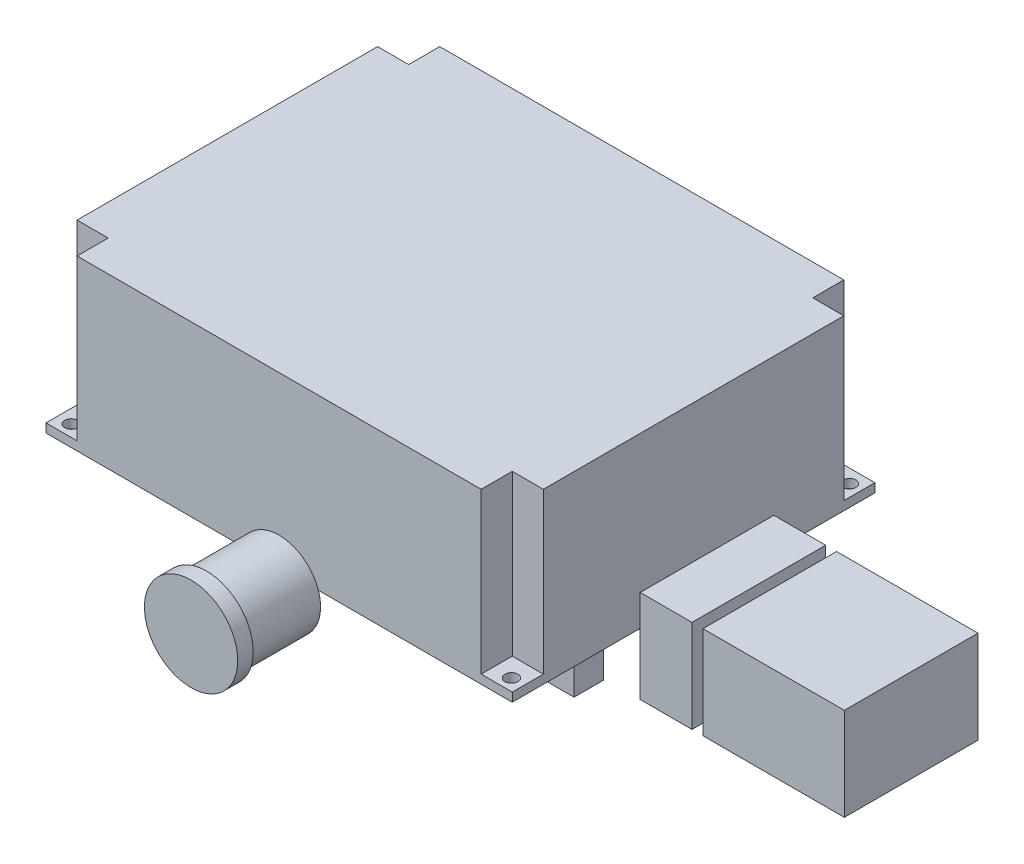
from build123d import *

# Parameters (mm, degrees)
SKETCH2_W               = 90
SKETCH2_H               = 70
BOSS_EXTRUDE1_DEPTH     = 32.6
SKETCH4_R               = 8
BOSS_EXTRUDE2_DEPTH     = 14
SKETCH6_W               = 6.6
SKETCH6_H               = 5.7
BOSS_EXTRUDE3_DEPTH     = 10
SKETCH10_W              = 6.6
SKETCH10_H              = 5.7
BOSS_EXTRUDE4_DEPTH     = 10
SKETCH7_W               = 6.6
SKETCH7_H               = 5.7
BOSS_EXTRUDE5_DEPTH     = 10
CUT_EXTRUDE1_DEPTH      = 122.916565322
CUT_EXTRUDE1_DEPTH_BACK = 122.916565322
SKETCH11_R              = 1.25
CUT_EXTRUDE2_DEPTH      = 122.916565322
CUT_EXTRUDE2_DEPTH_BACK = 122.916565322
SKETCH15_R              = 1.25
CUT_EXTRUDE3_DEPTH      = 122.916565322
CUT_EXTRUDE3_DEPTH_BACK = 122.916565322
SKETCH14_R              = 1.25
CUT_EXTRUDE4_DEPTH      = 122.916565322
CUT_EXTRUDE4_DEPTH_BACK = 122.916565322
SKETCH12_R              = 1.25
SKETCH16_W              = 6
SKETCH16_H              = 6
CUT_EXTRUDE5_DEPTH      = 30.9
SKETCH19_W              = 6
SKETCH19_H              = 6
CUT_EXTRUDE6_DEPTH      = 30.9
SKETCH18_W              = 6
SKETCH18_H              = 6
CUT_EXTRUDE7_DEPTH      = 30.9
SKETCH17_W              = 6
SKETCH17_H              = 6
CUT_EXTRUDE8_DEPTH      = 30.9
SKETCH20_W              = 25.8
SKETCH20_H              = 17.9
BOSS_EXTRUDE6_DEPTH     = 39.4
SKETCH22_W              = 2.1
SKETCH22_H              = 17.9
CUT_EXTRUDE9_DEPTH      = 2.75
SKETCH24_W              = 2.1
SKETCH24_H              = 25.8
CUT_EXTRUDE10_DEPTH     = 2.75
SKETCH25_W              = 2.1
SKETCH25_H              = 17.9
CUT_EXTRUDE11_DEPTH     = 2.75
SKETCH26_W              = 2.1
SKETCH26_H              = 25.8
CUT_EXTRUDE12_DEPTH     = 2.75
SKETCH27_R              = 9
BOSS_EXTRUDE7_DEPTH     = 3


with BuildPart() as part:
    # Sketch2 → Boss-Extrude1 (new body)
    with BuildSketch(Plane(origin=(0, 0, 0), x_dir=(1, 0, 0), z_dir=(0, 1, 0))):
        with Locations((45, 35)):
            Rectangle(SKETCH2_W, SKETCH2_H)
    extrude(amount=BOSS_EXTRUDE1_DEPTH)

    # Sketch4 → Boss-Extrude2 (add)
    with BuildSketch(Plane.XY):
        with Locations(Location((45, -2.57, 0), (0, 0, 161.261463564))):
            Circle(SKETCH4_R)
    extrude(amount=BOSS_EXTRUDE2_DEPTH)

    # Sketch6 → Boss-Extrude3 (add)
    with BuildSketch(Plane(origin=(0, 0, 0), x_dir=(-1, 0, 0), z_dir=(0, -1, 0))):
        with Locations((-81.82, 55.55)):
            Rectangle(SKETCH6_W, SKETCH6_H)
    extrude(amount=BOSS_EXTRUDE3_DEPTH)

    # Sketch10 → Boss-Extrude4 (add)
    with BuildSketch(Plane.XZ):
        with Locations((81.82, -37.25)):
            Rectangle(SKETCH10_W, SKETCH10_H)
    extrude(amount=BOSS_EXTRUDE4_DEPTH)

    # Sketch7 → Boss-Extrude5 (add)
    with BuildSketch(Plane.XZ):
        with Locations((81.82, -19.65)):
            Rectangle(SKETCH7_W, SKETCH7_H)
    extrude(amount=BOSS_EXTRUDE5_DEPTH)

    # Sketch11 → Cut-Extrude1 (cut, two sides: drawn at the far end of the back side and taken through both)
    with BuildSketch(Plane(origin=(0, 32.6, 0), x_dir=(1, 0, 0), z_dir=(0, 1, 0)).offset(-CUT_EXTRUDE1_DEPTH_BACK)):
        with Locations(Location((87.55, 2.29, 0), (0, 0, 90))):
            Circle(SKETCH11_R)
    extrude(amount=CUT_EXTRUDE1_DEPTH + CUT_EXTRUDE1_DEPTH_BACK, mode=Mode.SUBTRACT)

    # Sketch15 → Cut-Extrude2 (cut, two sides: drawn at the far end of the back side and taken through both)
    with BuildSketch(Plane(origin=(0, 32.6, 0), x_dir=(1, 0, 0), z_dir=(0, 1, 0)).offset(-CUT_EXTRUDE2_DEPTH_BACK)):
        with Locations(Location((2.61, 67.35, 0), (0, 0, 90))):
            Circle(SKETCH15_R)
    extrude(amount=CUT_EXTRUDE2_DEPTH + CUT_EXTRUDE2_DEPTH_BACK, mode=Mode.SUBTRACT)

    # Sketch14 → Cut-Extrude3 (cut, two sides: drawn at the far end of the back side and taken through both)
    with BuildSketch(Plane(origin=(0, 32.6, 0), x_dir=(1, 0, 0), z_dir=(0, 1, 0)).offset(-CUT_EXTRUDE3_DEPTH_BACK)):
        with Locations(Location((2.63, 2.25, 0), (0, 0, 90))):
            Circle(SKETCH14_R)
    extrude(amount=CUT_EXTRUDE3_DEPTH + CUT_EXTRUDE3_DEPTH_BACK, mode=Mode.SUBTRACT)

    # Sketch12 → Cut-Extrude4 (cut, two sides: drawn at the far end of the back side and taken through both)
    with BuildSketch(Plane(origin=(0, 32.6, 0), x_dir=(1, 0, 0), z_dir=(0, 1, 0)).offset(-CUT_EXTRUDE4_DEPTH_BACK)):
        with Locations(Location((87.71, 67.37, 0), (0, 0, 90))):
            Circle(SKETCH12_R)
    extrude(amount=CUT_EXTRUDE4_DEPTH + CUT_EXTRUDE4_DEPTH_BACK, mode=Mode.SUBTRACT)

    # Sketch16 → Cut-Extrude5 (cut)
    with BuildSketch(Plane(origin=(0, 32.6, 0), x_dir=(1, 0, 0), z_dir=(0, 1, 0))):
        with Locations((3, 67)):
            Rectangle(SKETCH16_W, SKETCH16_H)
    extrude(amount=-CUT_EXTRUDE5_DEPTH, mode=Mode.SUBTRACT)

    # Sketch19 → Cut-Extrude6 (cut)
    with BuildSketch(Plane(origin=(0, 32.6, 0), x_dir=(1, 0, 0), z_dir=(0, 1, 0))):
        with Locations((3, 3)):
            Rectangle(SKETCH19_W, SKETCH19_H)
    extrude(amount=-CUT_EXTRUDE6_DEPTH, mode=Mode.SUBTRACT)

    # Sketch18 → Cut-Extrude7 (cut)
    with BuildSketch(Plane(origin=(0, 32.6, 0), x_dir=(1, 0, 0), z_dir=(0, 1, 0))):
        with Locations((87, 3)):
            Rectangle(SKETCH18_W, SKETCH18_H)
    extrude(amount=-CUT_EXTRUDE7_DEPTH, mode=Mode.SUBTRACT)

    # Sketch17 → Cut-Extrude8 (cut)
    with BuildSketch(Plane(origin=(0, 32.6, 0), x_dir=(1, 0, 0), z_dir=(0, 1, 0))):
        with Locations((87, 67)):
            Rectangle(SKETCH17_W, SKETCH17_H)
    extrude(amount=-CUT_EXTRUDE8_DEPTH, mode=Mode.SUBTRACT)

    # Sketch20 → Boss-Extrude6 (add)
    with BuildSketch(Plane(origin=(90, 0, 0), x_dir=(0, 0, -1), z_dir=(1, 0, 0))):
        with Locations((37.6, -2.95)):
            Rectangle(SKETCH20_W, SKETCH20_H)
    extrude(amount=BOSS_EXTRUDE6_DEPTH)

    # Sketch22 → Cut-Extrude9 (cut)
    with BuildSketch(Plane(origin=(0, 0, -50.5), x_dir=(-1, 0, 0), z_dir=(0, 0, -1))):
        with Locations((-101.05, -2.95)):
            Rectangle(SKETCH22_W, SKETCH22_H)
    extrude(amount=-CUT_EXTRUDE9_DEPTH, mode=Mode.SUBTRACT)

    # Sketch24 → Cut-Extrude10 (cut)
    with BuildSketch(Plane(origin=(0, 6, 0), x_dir=(1, 0, 0), z_dir=(0, 1, 0))):
        with Locations((101.05, 37.6)):
            Rectangle(SKETCH24_W, SKETCH24_H)
    extrude(amount=-CUT_EXTRUDE10_DEPTH, mode=Mode.SUBTRACT)

    # Sketch25 → Cut-Extrude11 (cut)
    with BuildSketch(Plane.XY.offset(-24.7)):
        with Locations((101.05, -2.95)):
            Rectangle(SKETCH25_W, SKETCH25_H)
    extrude(amount=-CUT_EXTRUDE11_DEPTH, mode=Mode.SUBTRACT)

    # Sketch26 → Cut-Extrude12 (cut)
    with BuildSketch(Plane(origin=(0, -11.9, 0), x_dir=(-1, 0, 0), z_dir=(0, -1, 0))):
        with Locations((-101.05, 37.6)):
            Rectangle(SKETCH26_W, SKETCH26_H)
    extrude(amount=-CUT_EXTRUDE12_DEPTH, mode=Mode.SUBTRACT)

    # Sketch27 → Boss-Extrude7 (add)
    with BuildSketch(Plane.XY.offset(14)):
        with Locations((45, -2.57)):
            Circle(SKETCH27_R)
    extrude(amount=BOSS_EXTRUDE7_DEPTH)


solid = part.part
